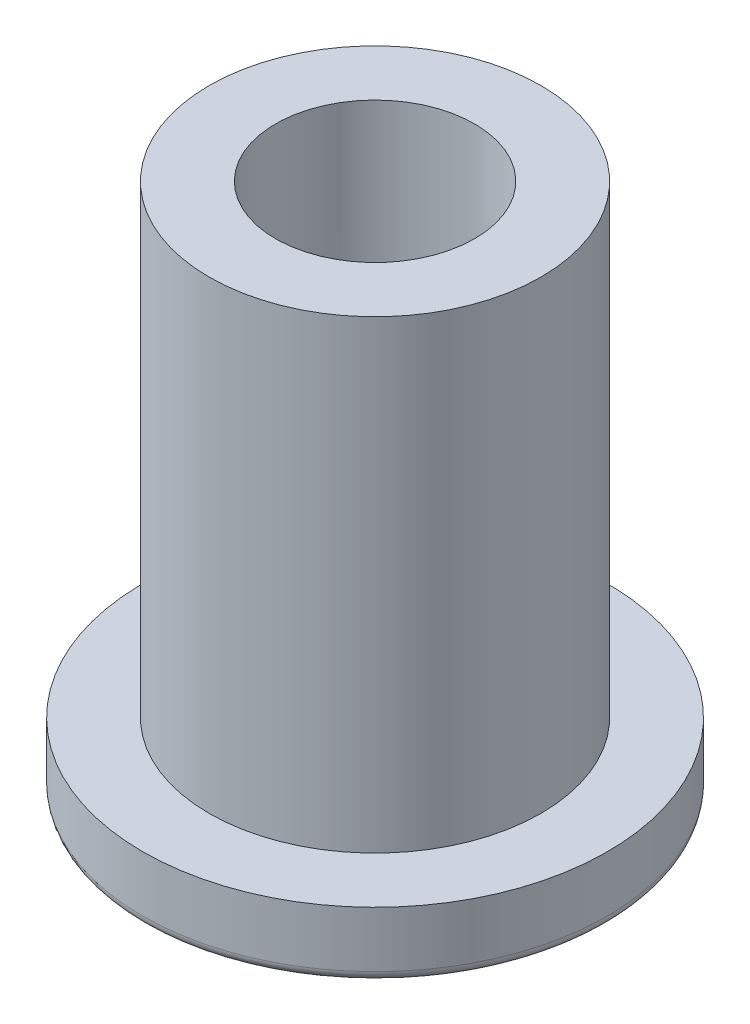
from build123d import *

# Parameters (mm, degrees)
SKETCH1_R           = 5.55625
BOSS_EXTRUDE1_DEPTH = 1.5875
SKETCH2_R           = 3.96875
SKETCH2_R_2         = 2.38125
EXTRUDE_THIN1_DEPTH = 11.1125
FILLET1_R           = 0.254


with BuildPart() as part:
    # Sketch1 → Boss-Extrude1 (new body)
    with BuildSketch(Plane(origin=(0, 0, 0), x_dir=(1, 0, 0), z_dir=(0, 1, 0))):
        Circle(SKETCH1_R)
    extrude(amount=BOSS_EXTRUDE1_DEPTH)

    # Sketch2 → Extrude-Thin1 (add)
    with BuildSketch(Plane(origin=(0, 1.5875, 0), x_dir=(1, 0, 0), z_dir=(0, 1, 0))):
        Circle(SKETCH2_R)
        Circle(SKETCH2_R_2, mode=Mode.SUBTRACT)
    extrude(amount=EXTRUDE_THIN1_DEPTH)

    # Fillet1
    fillet1_edges = [part.edges().sort_by_distance(p)[0] for p in [
        (-5.55625, 0, 0),
    ]]
    fillet(fillet1_edges, radius=FILLET1_R)


solid = part.part
